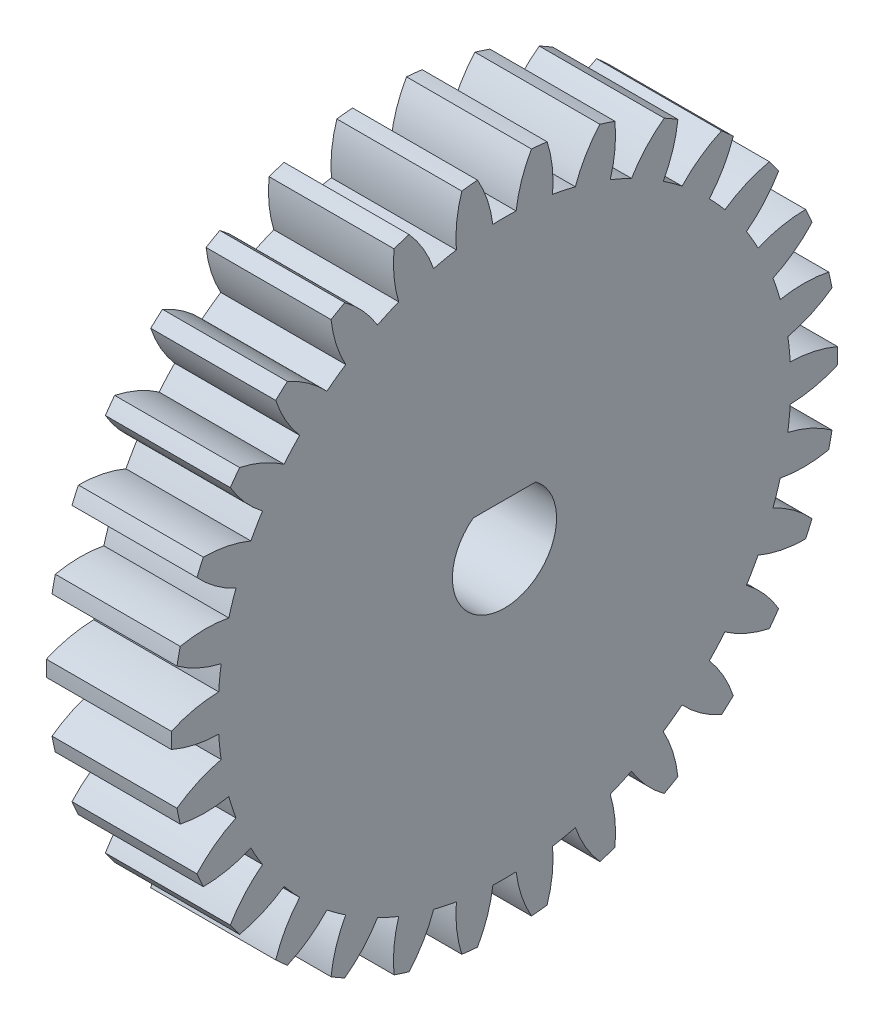
from build123d import *

# Parameters (mm, degrees)
BASPROSKE_W         = 6
BASPROSKE_H         = 16
TOOTHCUT_DEPTH      = 24.409399821
TEETHCUTS_COUNT     = 30
TEETHCUTS_ANGLE     = 348
BORSKE_R            = 2.5
BORE_DEPTH          = 50.0000508
BOSS_EXTRUDE1_DEPTH = 6


with BuildPart() as part:
    # BasProSke → Base-Revolve (revolve)
    with BuildSketch(Plane(origin=(0, 0, 0), x_dir=(1, 0, 0), z_dir=(0, 1, 0)), mode=Mode.PRIVATE) as base_revolve_sk:
        with Locations((3, 8)):
            Rectangle(BASPROSKE_W, BASPROSKE_H)
    revolve(base_revolve_sk.sketch.rotate(Axis((-10, 0, 0), (1, 0, 0)), 180), axis=Axis((-10, 0, 0), (1, 0, 0)))

    # TooCutSke → ToothCut (cut, through all)
    with BuildSketch(Plane(origin=(0, 0, 0), x_dir=(0, 0, -1), z_dir=(1, 0, 0))):
        with BuildLine():
            ThreePointArc((0.558154026, 13.737665926), (0, 13.749), (-0.558154026, 13.737665926))
            ThreePointArc((-0.558154026, 13.737665926), (-0.82267139, 14.891986419), (-1.308756454, 15.971869074))
            ThreePointArc((-1.308756454, 15.971869074), (0, 16.0254), (1.308756454, 15.971869074))
            ThreePointArc((1.308756454, 15.971869074), (0.82267139, 14.891986419), (0.558154026, 13.737665926))
        make_face()
    toothcut = extrude(amount=TOOTHCUT_DEPTH, mode=Mode.SUBTRACT)

    # TeethCuts: ToothCut ×30 about axis
    teethcuts_axis = Axis((-10, 0, 0), (1, 0, 0))
    for i in range(1, TEETHCUTS_COUNT):
        add(toothcut.rotate(teethcuts_axis, i * TEETHCUTS_ANGLE / (TEETHCUTS_COUNT - 1)), mode=Mode.SUBTRACT)

    # BorSke → Bore (cut, symmetric)
    with BuildSketch(Plane(origin=(0, 0, 0), x_dir=(0, 0, -1), z_dir=(1, 0, 0))):
        with Locations(Location((0, 0, 0), (0, 0, 180))):
            Circle(BORSKE_R)
    extrude(amount=BORE_DEPTH, both=True, mode=Mode.SUBTRACT)

    # Sketch1 → Boss-Extrude1 (add)
    with BuildSketch(Plane(origin=(6, 0, 0), x_dir=(0, 0, -1), z_dir=(1, 0, 0))):
        with BuildLine():
            Line((-1.5, 2), (1.5, 2))
            ThreePointArc((1.5, 2), (0, 2.5), (-1.5, 2))
        make_face()
    extrude(amount=-BOSS_EXTRUDE1_DEPTH)


solid = part.part
